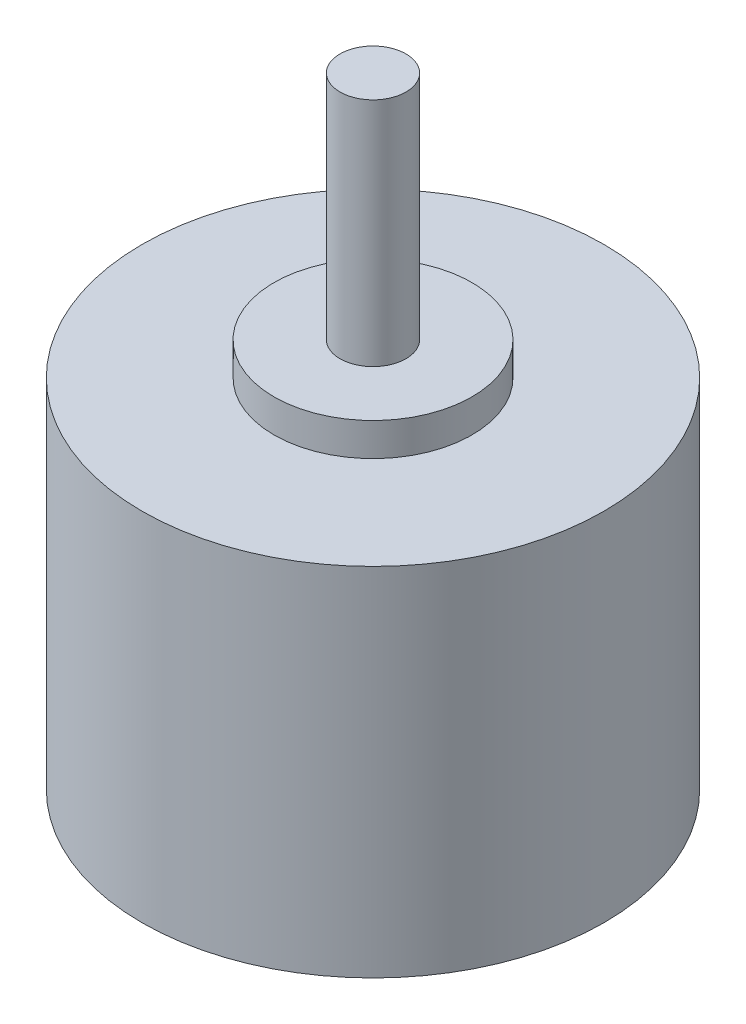
from build123d import *

# Parameters (mm, degrees)
ESQUISSE1_R        = 17.5
BOSS_EXTRU_1_DEPTH = 27
ESQUISSE2_R        = 7.5
BOSS_EXTRU_2_DEPTH = 2.5
ESQUISSE3_R        = 2.5
BOSS_EXTRU_3_DEPTH = 17.5


with BuildPart() as part:
    # Esquisse1 → Boss.-Extru.1 (new body)
    with BuildSketch(Plane(origin=(0, 0, 0), x_dir=(1, 0, 0), z_dir=(0, 1, 0))):
        with Locations(Location((0, 0, 0), (0, 0, 270))):
            Circle(ESQUISSE1_R)
    extrude(amount=BOSS_EXTRU_1_DEPTH)

    # Esquisse2 → Boss.-Extru.2 (add)
    with BuildSketch(Plane(origin=(0, 27, 0), x_dir=(1, 0, 0), z_dir=(0, 1, 0))):
        with Locations(Location((0, 0, 0), (0, 0, 270))):
            Circle(ESQUISSE2_R)
    extrude(amount=BOSS_EXTRU_2_DEPTH)

    # Esquisse3 → Boss.-Extru.3 (add)
    with BuildSketch(Plane(origin=(0, 29.5, 0), x_dir=(1, 0, 0), z_dir=(0, 1, 0))):
        with Locations(Location((0, 0, 0), (0, 0, 270))):
            Circle(ESQUISSE3_R)
    extrude(amount=BOSS_EXTRU_3_DEPTH)


solid = part.part
